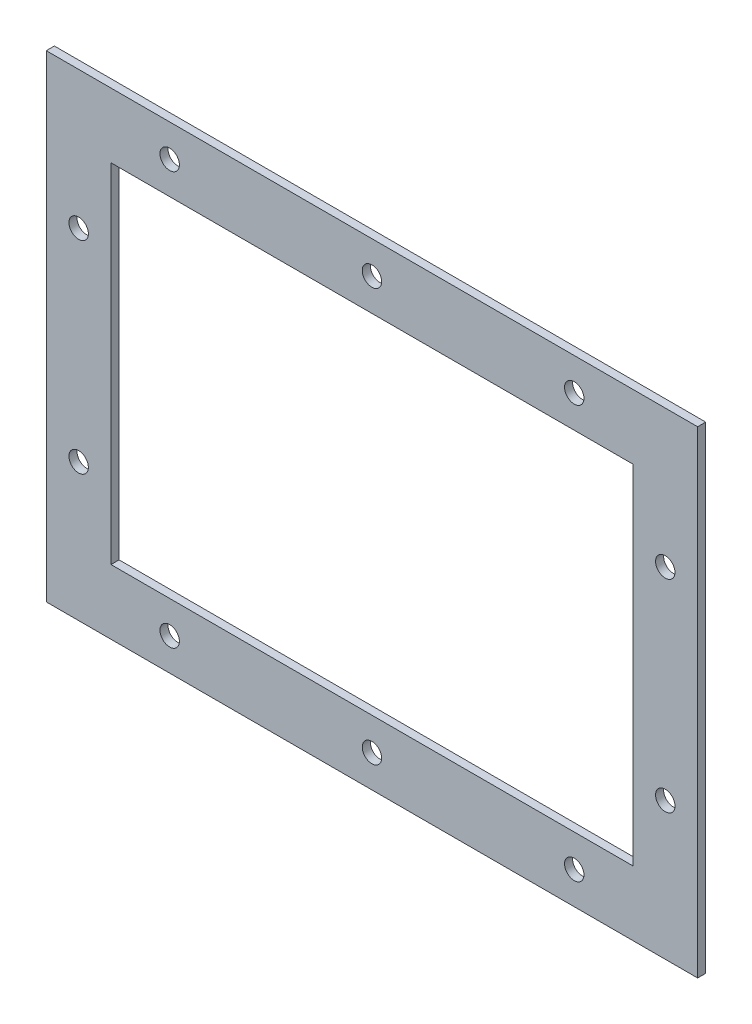
from build123d import *

# Parameters (mm, degrees)
SKETCH1_W           = 402.5
SKETCH1_H           = 295
SKETCH1_W_2         = 322.5
SKETCH1_H_2         = 215
BOSS_EXTRUDE1_DEPTH = 5
SKETCH2_R           = 6
CUT_EXTRUDE1_DEPTH  = 5


with BuildPart() as part:
    # Sketch1 → Boss-Extrude1 (new body)
    with BuildSketch(Plane.XY):
        with Locations((-32.469887955, 7)):
            Rectangle(SKETCH1_W, SKETCH1_H)
        with Locations((-32.469887955, 7)):
            Rectangle(SKETCH1_W_2, SKETCH1_H_2, mode=Mode.SUBTRACT)
    extrude(amount=BOSS_EXTRUDE1_DEPTH)

    # Sketch2 → Cut-Extrude1 (cut)
    with BuildSketch(Plane.XY.offset(5)):
        with Locations((-213.719887955, 69.5)):
            Circle(SKETCH2_R)
        with Locations((-213.719887955, -55.5)):
            Circle(SKETCH2_R)
        with Locations(Location((-157.469887955, -120.5, 0), (0, 0, 180))):
            Circle(SKETCH2_R)
        with Locations(Location((-32.469887955, -120.5, 0), (0, 0, 180))):
            Circle(SKETCH2_R)
        with Locations(Location((92.530112045, -120.5, 0), (0, 0, 180))):
            Circle(SKETCH2_R)
        with Locations((92.530112045, 134.5)):
            Circle(SKETCH2_R)
        with Locations((-32.469887955, 134.5)):
            Circle(SKETCH2_R)
        with Locations((-157.469887955, 134.5)):
            Circle(SKETCH2_R)
        with Locations(Location((148.780112045, -55.5, 0), (0, 0, 180))):
            Circle(SKETCH2_R)
        with Locations(Location((148.780112045, 69.5, 0), (0, 0, 180))):
            Circle(SKETCH2_R)
    extrude(amount=-CUT_EXTRUDE1_DEPTH, mode=Mode.SUBTRACT)


solid = part.part
